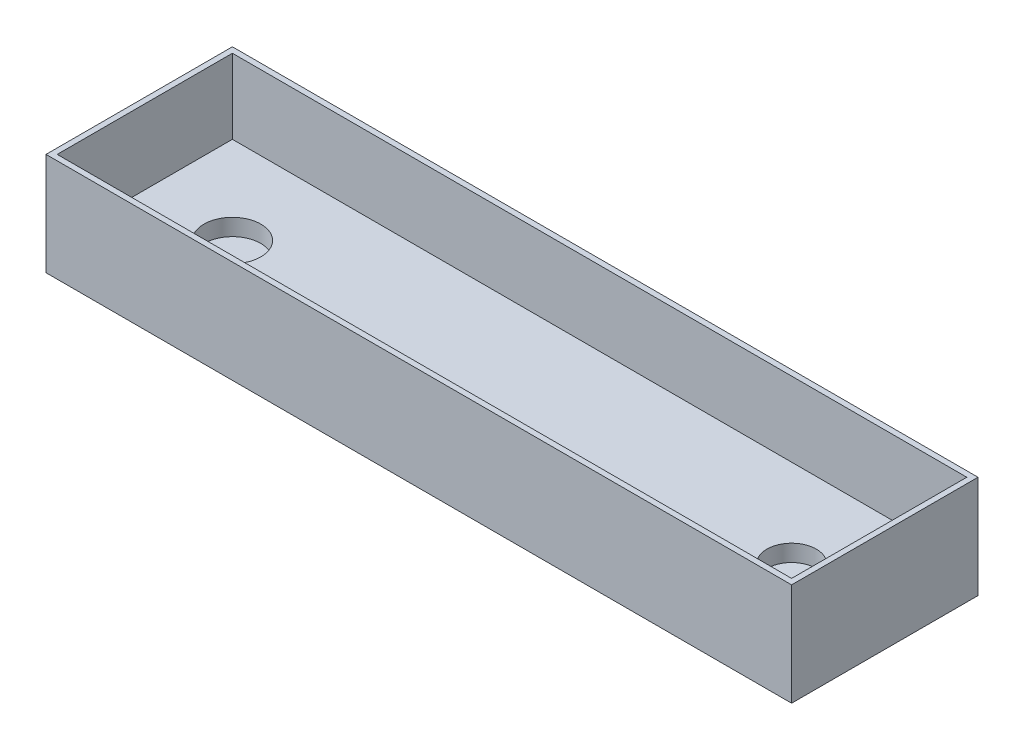
from build123d import *

# Parameters (mm, degrees)
SKETCH1_W           = 400
SKETCH1_H           = 100
BOSS_EXTRUDE1_DEPTH = 15
SKETCH2_R           = 15.25
SKETCH2_R_2         = 13.25
CUT_EXTRUDE1_DEPTH  = 9
SKETCH3_W           = 400
SKETCH3_H           = 100
SKETCH3_W_2         = 394
SKETCH3_H_2         = 94
BOSS_EXTRUDE2_DEPTH = 40


with BuildPart() as part:
    # Sketch1 → Boss-Extrude1 (new body)
    with BuildSketch(Plane(origin=(0, 0, 0), x_dir=(1, 0, 0), z_dir=(0, 1, 0))):
        Rectangle(SKETCH1_W, SKETCH1_H)
    extrude(amount=BOSS_EXTRUDE1_DEPTH)

    # Sketch2 → Cut-Extrude1 (cut)
    with BuildSketch(Plane(origin=(0, 15, 0), x_dir=(1, 0, 0), z_dir=(0, 1, 0))):
        with Locations(Location((-150, 0, 0), (0, 0, 270))):
            Circle(SKETCH2_R)
        with Locations(Location((150, 0, 0), (0, 0, 270))):
            Circle(SKETCH2_R_2)
    extrude(amount=-CUT_EXTRUDE1_DEPTH, mode=Mode.SUBTRACT)

    # Sketch3 → Boss-Extrude2 (add)
    with BuildSketch(Plane(origin=(0, 15, 0), x_dir=(1, 0, 0), z_dir=(0, 1, 0))):
        Rectangle(SKETCH3_W, SKETCH3_H)
        Rectangle(SKETCH3_W_2, SKETCH3_H_2, mode=Mode.SUBTRACT)
    extrude(amount=BOSS_EXTRUDE2_DEPTH)


solid = part.part
